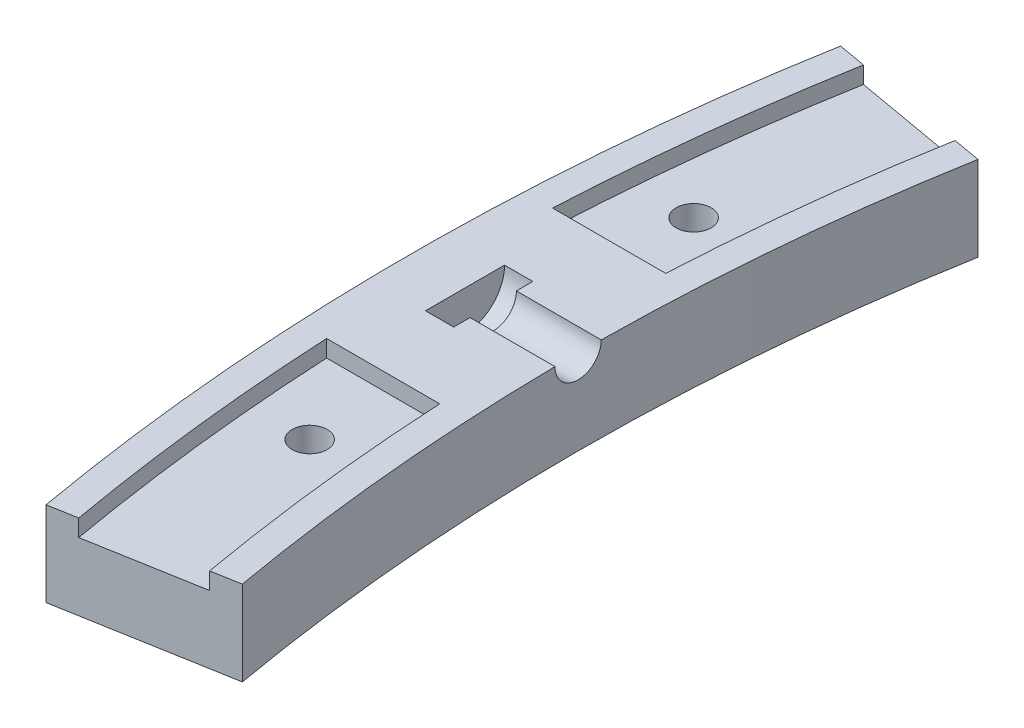
from build123d import *

# Parameters (mm, degrees)
BOSS_EXTRUDE1_DEPTH        = 7.5
CUT_EXTRUDE1_DEPTH         = 1.5
SKETCH4_R                  = 3.5
CUT_EXTRUDE3_DEPTH         = 2.5
SKETCH5_R                  = 2.05
CUT_EXTRUDE4_DEPTH         = 38.414330746
F_3_1_3_1_DIAMETER_HOLE1_D = 3.1


with BuildPart() as part:
    # Sketch1 → Boss-Extrude1 (new body)
    with BuildSketch(Plane(origin=(0, 0, 0), x_dir=(1, 0, 0), z_dir=(0, 1, 0))):
        with BuildLine():
            Line((-199.423569985, 35.163755978), (-184.65145369, 32.559033313))
            ThreePointArc((-184.65145369, 32.559033313), (-187.5, 0), (-184.65145369, -32.559033313))
            Line((-184.65145369, -32.559033313), (-199.423569985, -35.163755978))
            ThreePointArc((-199.423569985, -35.163755978), (-202.5, 0), (-199.423569985, 35.163755978))
        make_face()
    extrude(amount=BOSS_EXTRUDE1_DEPTH)

    # Sketch2 → Cut-Extrude1 (cut)
    with BuildSketch(Plane(origin=(0, 7.5, 0), x_dir=(1, 0, 0), z_dir=(0, 1, 0))):
        with BuildLine():
            Line((-187.113473072, 32.993153757), (-196.961550602, 34.729635533))
            ThreePointArc((-196.961550602, 34.729635533), (-198.7407137, 22.408228804), (-199.749843554, 10))
            Line((-199.749843554, 10), (-189.73665961, 10))
            ThreePointArc((-189.73665961, 10), (-188.775466906, 21.536552519), (-187.113473072, 32.993153757))
        make_face()
        with BuildLine():
            Line((-189.73665961, -10), (-199.749843554, -10))
            ThreePointArc((-199.749843554, -10), (-198.7407137, -22.408228804), (-196.961550602, -34.729635533))
            Line((-196.961550602, -34.729635533), (-187.113473072, -32.993153757))
            ThreePointArc((-187.113473072, -32.993153757), (-188.775466906, -21.536552519), (-189.73665961, -10))
        make_face()
    extrude(amount=-CUT_EXTRUDE1_DEPTH, mode=Mode.SUBTRACT)

    # Sketch4 → Cut-Extrude3 (cut)
    with BuildSketch(Plane(origin=(-195, 0, 0), x_dir=(0, 0, -1), z_dir=(1, 0, 0))):
        with Locations((0, 7.5)):
            Circle(SKETCH4_R)
    extrude(amount=-CUT_EXTRUDE3_DEPTH, mode=Mode.SUBTRACT)

    # Sketch5 → Cut-Extrude4 (cut, through all)
    with BuildSketch(Plane(origin=(-195, 0, 0), x_dir=(0, 0, -1), z_dir=(1, 0, 0))):
        with Locations((0, 7.5)):
            Circle(SKETCH5_R)
    extrude(amount=CUT_EXTRUDE4_DEPTH, mode=Mode.SUBTRACT)

    # Ø3.1 (3.1) Diameter Hole1 (through all)
    with Locations(Plane(origin=(0, 0, 0), x_dir=(-1, 0, 0), z_dir=(0, -1, 0))):
        with Locations((194.257966128, -16.995369836), (194.257966128, 16.995369836)):
            Hole(F_3_1_3_1_DIAMETER_HOLE1_D / 2)


solid = part.part
